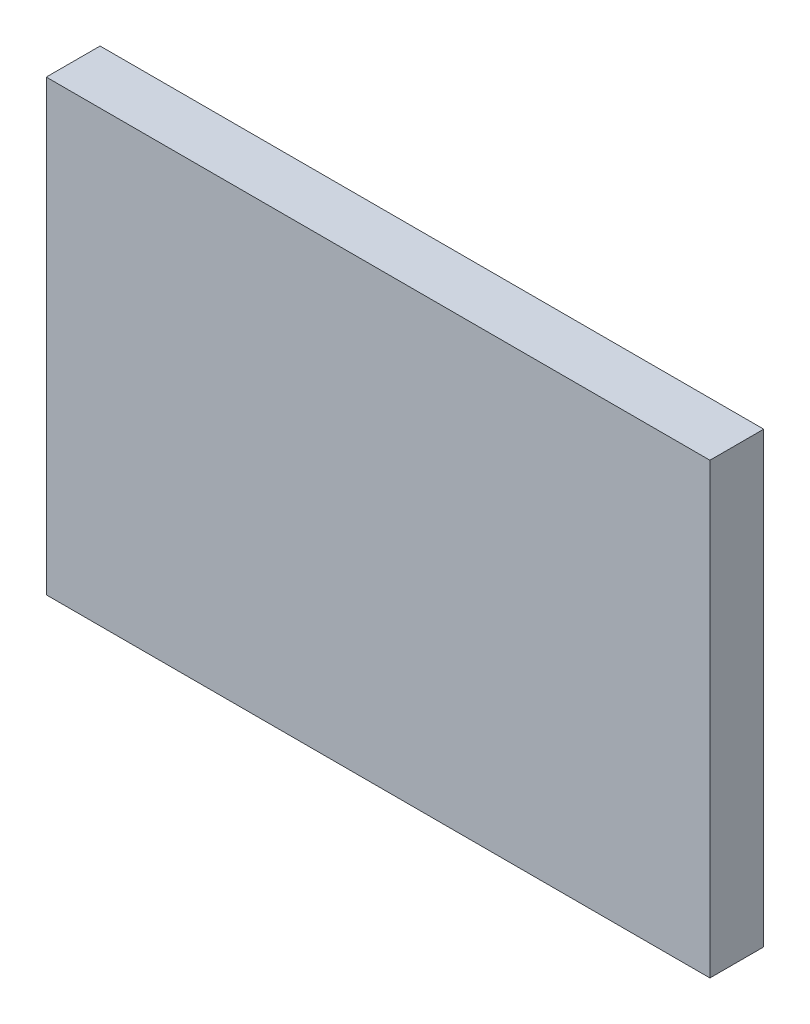
from build123d import *

# Parameters (mm, degrees)
SKETCH1_W           = 74
SKETCH1_H           = 50
BOSS_EXTRUDE1_DEPTH = 6


with BuildPart() as part:
    # Sketch1 → Boss-Extrude1 (new body)
    with BuildSketch(Plane.XY):
        Rectangle(SKETCH1_W, SKETCH1_H)
    extrude(amount=BOSS_EXTRUDE1_DEPTH)


solid = part.part
